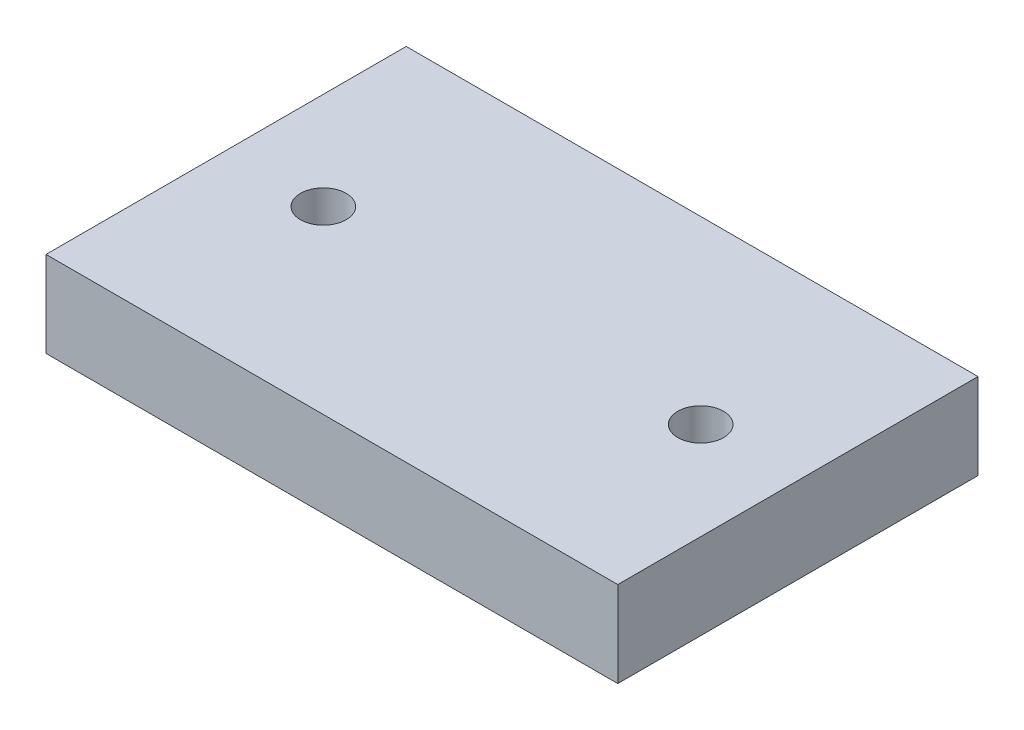
from build123d import *

# Parameters (mm, degrees)
CROQUIS1_W              = 100
CROQUIS1_H              = 63
CROQUIS1_R              = 4
SALIENTE_EXTRUIR1_DEPTH = 15


with BuildPart() as part:
    # Croquis1 → Saliente-Extruir1 (new body)
    with BuildSketch(Plane(origin=(0, 0, 0), x_dir=(1, 0, 0), z_dir=(0, 1, 0))):
        with Locations((50, 31.5)):
            Rectangle(CROQUIS1_W, CROQUIS1_H)
        with Locations(Location((17, 31.5, 0), (0, 0, 270))):
            Circle(CROQUIS1_R, mode=Mode.SUBTRACT)
        with Locations(Location((83, 31.5, 0), (0, 0, 270))):
            Circle(CROQUIS1_R, mode=Mode.SUBTRACT)
    extrude(amount=SALIENTE_EXTRUIR1_DEPTH)


solid = part.part
